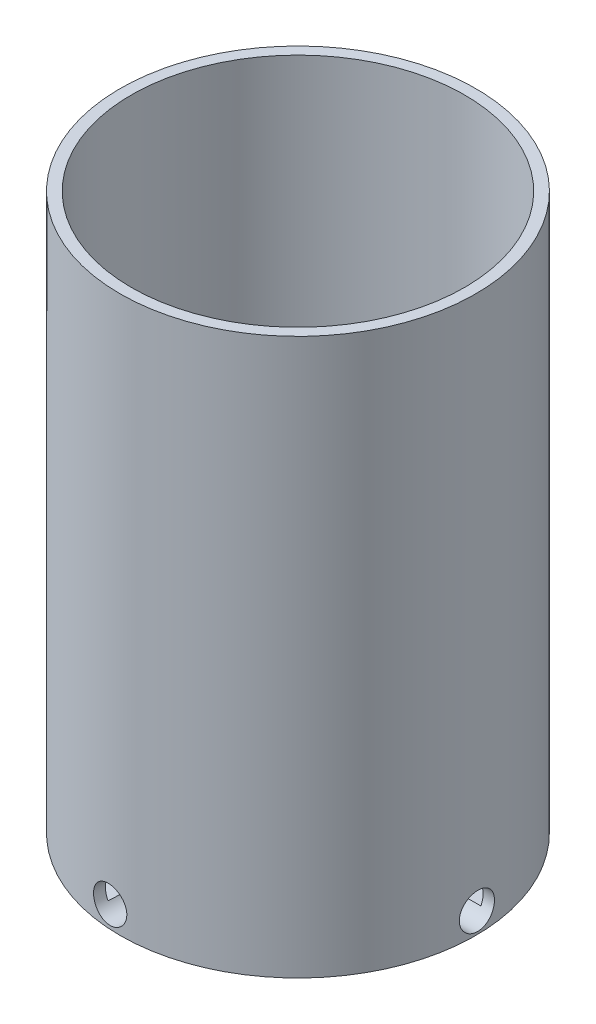
from build123d import *

# Parameters (mm, degrees)
SKETCH1_R                        = 80
BOSS_EXTRUDE1_DEPTH              = 250
SHELL3_T                         = -5
F_16_0MM_DOWEL_HOLE1_D           = 16
F_16_0MM_DOWEL_HOLE1_ON_FACE_2_D = 16


with BuildPart() as part:
    # Sketch1 → Boss-Extrude1 (new body)
    with BuildSketch(Plane(origin=(0, 0, 0), x_dir=(1, 0, 0), z_dir=(0, 1, 0))):
        with Locations(Location((0, 0, 0), (0, 0, 270))):
            Circle(SKETCH1_R)
    extrude(amount=BOSS_EXTRUDE1_DEPTH)

    # Shell3
    shell3_openings = [part.faces().sort_by_distance(p)[0] for p in [
        (0, 250, 0),
    ]]
    offset(amount=SHELL3_T, openings=shell3_openings, kind=Kind.INTERSECTION)

    # Ø16.0mm Dowel Hole1 (through all)
    with Locations(Plane(origin=(79.9948146, 9.136379981, -0.910844193), x_dir=(0.011385552407, 0, 0.999935182498), z_dir=(0.999935182498, 0, -0.011385552407))):
        with Locations((0, 0)):
            Hole(F_16_0MM_DOWEL_HOLE1_D / 2)

    # Ø16.0mm Dowel Hole1 on face 2 (through all)
    with Locations(Plane(origin=(-5.051729974, 9.526351975, 79.840340833), x_dir=(0.998004235716, 0, 0.063147014915), z_dir=(-0.063147014915, 0, 0.998004235716))):
        with Locations((0, 0)):
            Hole(F_16_0MM_DOWEL_HOLE1_ON_FACE_2_D / 2)


solid = part.part
